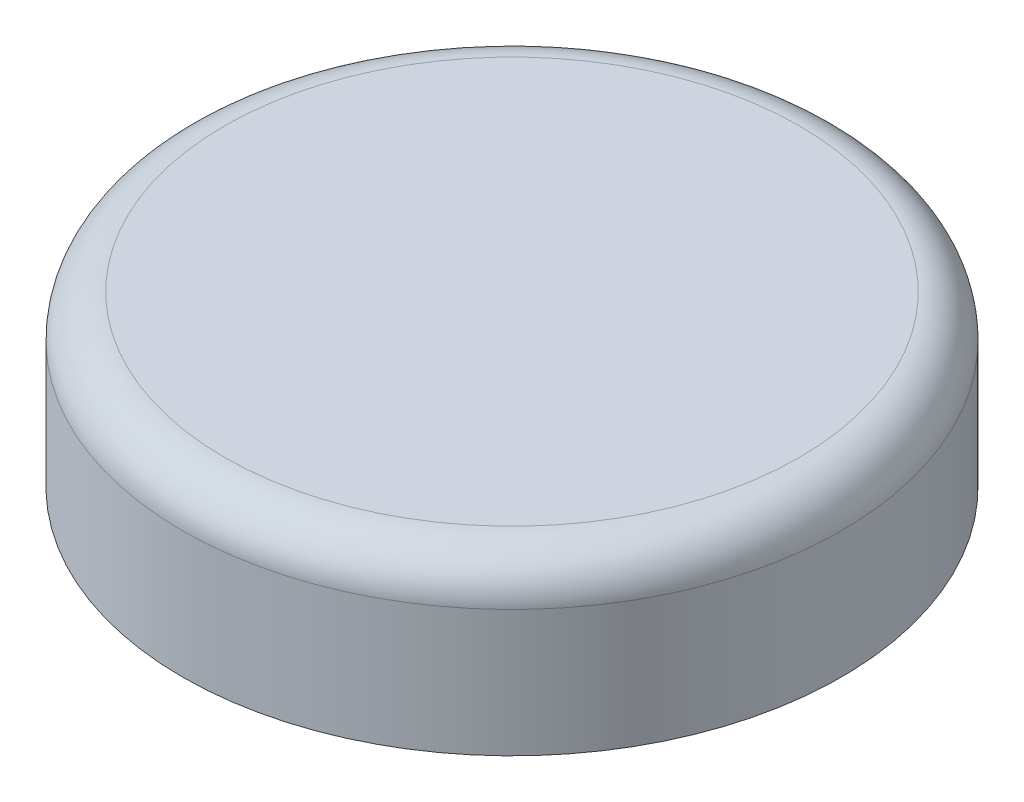
from build123d import *

# Parameters (mm, degrees)
SKETCH1_R           = 3.9
BOSS_EXTRUDE1_DEPTH = 2
FILLET1_R           = 0.5


with BuildPart() as part:
    # Sketch1 → Boss-Extrude1 (new body)
    with BuildSketch(Plane(origin=(0, 0, 0), x_dir=(1, 0, 0), z_dir=(0, 1, 0))):
        with Locations(Location((0, 0, 0), (0, 0, 270))):
            Circle(SKETCH1_R)
    extrude(amount=BOSS_EXTRUDE1_DEPTH)

    # Fillet1
    fillet1_edges = [part.edges().sort_by_distance(p)[0] for p in [
        (0, 2, -3.9),
    ]]
    fillet(fillet1_edges, radius=FILLET1_R)


solid = part.part
